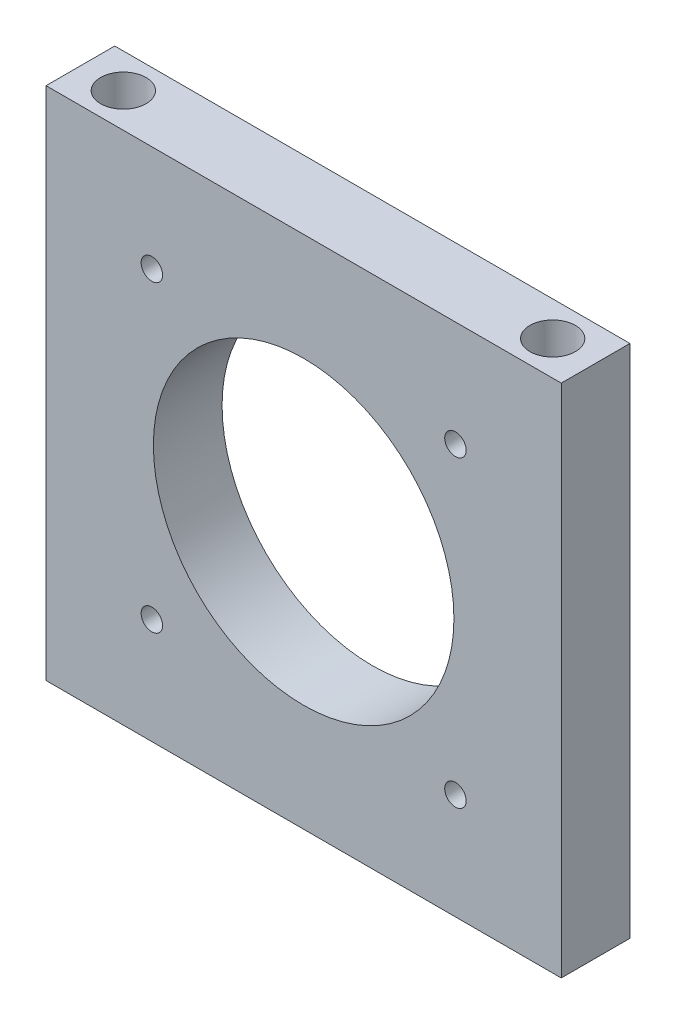
from build123d import *

# Parameters (mm, degrees)
SKETCH_1_W          = 60
SKETCH_1_H          = 60
EXTRUDE_1_DEPTH     = 4
SKETCH_2_R          = 17.5
CUT_EXTRUDE_1_DEPTH = 44.17406629
HOLE_WIZARD_M3_1_D  = 2.5
HOLE_WIZARD_M5_1_D  = 5.3


with BuildPart() as part:
    # 草圖1 → 填料-伸長1 (new, symmetric)
    with BuildSketch(Plane.XY):
        Rectangle(SKETCH_1_W, SKETCH_1_H)
    extrude(amount=EXTRUDE_1_DEPTH, both=True)

    # 草圖2 → 除料-伸長1 (cut, through all)
    with BuildSketch(Plane.XY.offset(4)):
        Circle(SKETCH_2_R)
    extrude(amount=-CUT_EXTRUDE_1_DEPTH, mode=Mode.SUBTRACT)

    # M3 螺紋孔1 (through all)
    with Locations(Plane.XY.offset(4)):
        with Locations((17.67766953, -17.67766953), (17.67766953, 17.67766953), (-17.67766953, -17.67766953), (-17.67766953, 17.67766953)):
            Hole(HOLE_WIZARD_M3_1_D / 2)

    # M5 餘隙孔1 (through all)
    with Locations(Plane(origin=(0, 30, 0), x_dir=(1, 0, 0), z_dir=(0, 1, 0))):
        with Locations((-25, 0), (25, 0)):
            Hole(HOLE_WIZARD_M5_1_D / 2)


solid = part.part
